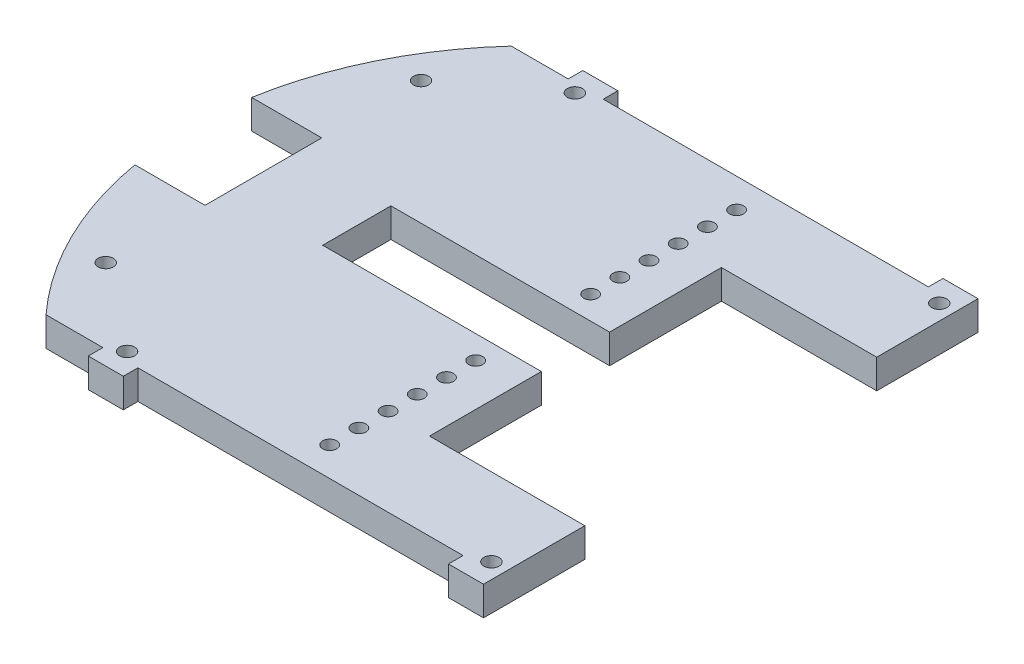
from build123d import *

# Parameters (mm, degrees)
SKETCH1_R           = 1.651
SKETCH1_R_2         = 1.524
BOSS_EXTRUDE1_DEPTH = 6.35


with BuildPart() as part:
    # Sketch1 → Boss-Extrude1 (new body)
    with BuildSketch(Plane(origin=(0, 0, 0), x_dir=(1, 0, 0), z_dir=(0, 1, 0))):
        with BuildLine():
            Line((33.776652136, 18.187342636), (4.627239322, 18.187342636))
            Line((4.627239322, 18.187342636), (4.627239322, 33.034266248))
            Line((4.627239322, 33.034266248), (33.776652136, 33.034266248))
            Line((33.776652136, 33.034266248), (52.191652136, 33.034266248))
            Line((52.191652136, 33.034266248), (52.191652136, 57.360804442))
            Line((52.191652136, 57.360804442), (85.968304273, 57.360804442))
            Line((85.968304273, 57.360804442), (85.968304273, 76.214266248))
            Line((85.968304273, 76.214266248), (85.968304273, 79.389266248))
            Line((85.968304273, 79.389266248), (78.348304273, 79.389266248))
            Line((78.348304273, 79.389266248), (78.348304273, 76.214266248))
            Line((78.348304273, 76.214266248), (7.62, 76.214266248))
            Line((7.62, 76.214266248), (7.62, 79.389266248))
            Line((7.62, 79.389266248), (0, 79.389266248))
            Line((0, 79.389266248), (0, 76.214266248))
            Line((0, 76.214266248), (-12.371874213, 76.214266248))
            ThreePointArc((-12.371874213, 76.214266248), (-24.373410945, 58.595023332), (-30.932760678, 38.310804442))
            Line((-30.932760678, 38.310804442), (-15.692760678, 38.310804442))
            Line((-15.692760678, 38.310804442), (-15.692760678, 12.910804442))
            Line((-15.692760678, 12.910804442), (-30.932760678, 12.910804442))
            ThreePointArc((-30.932760678, 12.910804442), (-24.373410945, -7.373414447), (-12.371874213, -24.992657364))
            Line((-12.371874213, -24.992657364), (0, -24.992657364))
            Line((0, -24.992657364), (0, -28.167657364))
            Line((0, -28.167657364), (7.62, -28.167657364))
            Line((7.62, -28.167657364), (7.62, -24.992657364))
            Line((7.62, -24.992657364), (78.348304273, -24.992657364))
            Line((78.348304273, -24.992657364), (78.348304273, -28.167657364))
            Line((78.348304273, -28.167657364), (85.968304273, -28.167657364))
            Line((85.968304273, -28.167657364), (85.968304273, -24.992657364))
            Line((85.968304273, -24.992657364), (85.968304273, -6.139195558))
            Line((85.968304273, -6.139195558), (52.191652136, -6.139195558))
            Line((52.191652136, -6.139195558), (52.191652136, 18.187342636))
            Line((52.191652136, 18.187342636), (33.776652136, 18.187342636))
        make_face()
        with Locations(Location((3.357239322, -23.087657364, 0), (0, 0, 270))):
            Circle(SKETCH1_R, mode=Mode.SUBTRACT)
        with Locations(Location((82.611064951, -23.087657364, 0), (0, 0, 270))):
            Circle(SKETCH1_R, mode=Mode.SUBTRACT)
        with Locations(Location((42.984152136, -12.292657364, 0), (0, 0, 270))):
            Circle(SKETCH1_R_2, mode=Mode.SUBTRACT)
        with Locations(Location((42.984152136, -18.642657364, 0), (0, 0, 270))):
            Circle(SKETCH1_R_2, mode=Mode.SUBTRACT)
        with Locations(Location((42.984152136, -5.942657364, 0), (0, 0, 270))):
            Circle(SKETCH1_R_2, mode=Mode.SUBTRACT)
        with Locations(Location((42.984152136, 0.407342636, 0), (0, 0, 270))):
            Circle(SKETCH1_R_2, mode=Mode.SUBTRACT)
        with Locations(Location((42.984152136, 6.757342636, 0), (0, 0, 270))):
            Circle(SKETCH1_R_2, mode=Mode.SUBTRACT)
        with Locations(Location((42.984152136, 13.107342636, 0), (0, 0, 270))):
            Circle(SKETCH1_R_2, mode=Mode.SUBTRACT)
        with Locations(Location((42.984152136, 38.114266248, 0), (0, 0, 90))):
            Circle(SKETCH1_R_2, mode=Mode.SUBTRACT)
        with Locations(Location((82.611064951, 74.309266248, 0), (0, 0, 90))):
            Circle(SKETCH1_R, mode=Mode.SUBTRACT)
        with Locations(Location((3.357239322, 74.309266248, 0), (0, 0, 90))):
            Circle(SKETCH1_R, mode=Mode.SUBTRACT)
        with Locations(Location((-15.692760678, 59.900804442, 0), (0, 0, 270))):
            Circle(SKETCH1_R, mode=Mode.SUBTRACT)
        with Locations(Location((-15.692760678, -8.679195558, 0), (0, 0, 270))):
            Circle(SKETCH1_R, mode=Mode.SUBTRACT)
        with Locations(Location((42.984152136, 44.464266248, 0), (0, 0, 90))):
            Circle(SKETCH1_R_2, mode=Mode.SUBTRACT)
        with Locations(Location((42.984152136, 50.814266248, 0), (0, 0, 90))):
            Circle(SKETCH1_R_2, mode=Mode.SUBTRACT)
        with Locations(Location((42.984152136, 57.164266248, 0), (0, 0, 90))):
            Circle(SKETCH1_R_2, mode=Mode.SUBTRACT)
        with Locations(Location((42.984152136, 63.514266248, 0), (0, 0, 90))):
            Circle(SKETCH1_R_2, mode=Mode.SUBTRACT)
        with Locations(Location((42.984152136, 69.864266248, 0), (0, 0, 90))):
            Circle(SKETCH1_R_2, mode=Mode.SUBTRACT)
    extrude(amount=BOSS_EXTRUDE1_DEPTH)


solid = part.part
